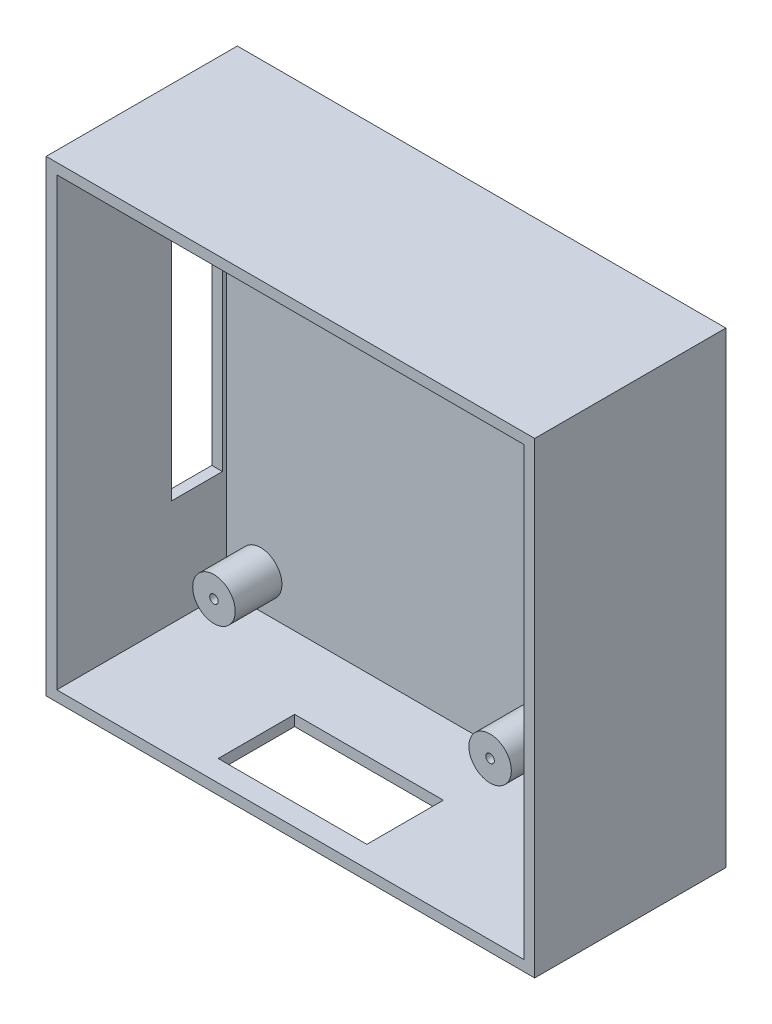
from build123d import *

# Parameters (mm, degrees)
SKETCH1_W           = 115
SKETCH1_H           = 110
BOSS_EXTRUDE1_DEPTH = 45
SKETCH2_W           = 110
SKETCH2_H           = 105
CUT_EXTRUDE1_DEPTH  = 40
SKETCH10_R          = 5
BOSS_EXTRUDE4_DEPTH = 11
SKETCH11_R          = 1
CUT_EXTRUDE8_DEPTH  = 85.689137438
CUT_EXTRUDE9_REACH  = 134.027
SKETCH14_W          = 35
SKETCH14_H          = 18
SKETCH16_W          = 12
SKETCH16_H          = 60
CUT_EXTRUDE10_DEPTH = 5


with BuildPart() as part:
    # Sketch1 → Boss-Extrude1 (new body)
    with BuildSketch(Plane.XY):
        Rectangle(SKETCH1_W, SKETCH1_H)
    extrude(amount=BOSS_EXTRUDE1_DEPTH)

    # Sketch2 → Cut-Extrude1 (cut)
    with BuildSketch(Plane.XY.offset(45)):
        Rectangle(SKETCH2_W, SKETCH2_H)
    extrude(amount=-CUT_EXTRUDE1_DEPTH, mode=Mode.SUBTRACT)

    # Sketch10 → Boss-Extrude4 (add)
    with BuildSketch(Plane.XY.offset(5)):
        with Locations(Location((-47, -44.5, 0), (0, 0, 180))):
            Circle(SKETCH10_R)
        with Locations(Location((18, -44.5, 0), (0, 0, 180))):
            Circle(SKETCH10_R)
        with Locations(Location((-47, 44.5, 0), (0, 0, 180))):
            Circle(SKETCH10_R)
        with Locations(Location((18, 44.5, 0), (0, 0, 180))):
            Circle(SKETCH10_R)
    extrude(amount=BOSS_EXTRUDE4_DEPTH)

    # Sketch11 → Cut-Extrude8 (cut, through all)
    with BuildSketch(Plane.XY.offset(16)):
        with Locations((-47, 44.5)):
            Circle(SKETCH11_R)
        with Locations((18, 44.5)):
            Circle(SKETCH11_R)
        with Locations((18, -44.5)):
            Circle(SKETCH11_R)
        with Locations((-47, -44.5)):
            Circle(SKETCH11_R)
    extrude(amount=-CUT_EXTRUDE8_DEPTH, mode=Mode.SUBTRACT)

    # Sketch14 → Cut-Extrude9 (cut, up to next)
    with BuildSketch(Plane.XZ.offset(55), mode=Mode.PRIVATE) as cut_extrude9_sk1:
        with Locations((-4.5, 31)):
            Rectangle(SKETCH14_W, SKETCH14_H)
    cut_extrude9_tool1 = extrude(cut_extrude9_sk1.sketch, amount=-CUT_EXTRUDE9_REACH, mode=Mode.PRIVATE) & part.part
    add(cut_extrude9_tool1.solids().sort_by_distance((-4.5, -55, 31))[0], mode=Mode.SUBTRACT)

    # Sketch16 → Cut-Extrude10 (cut)
    with BuildSketch(Plane.ZY.offset(57.5)):
        with Locations((12, 2.5)):
            Rectangle(SKETCH16_W, SKETCH16_H)
    extrude(amount=-CUT_EXTRUDE10_DEPTH, mode=Mode.SUBTRACT)


solid = part.part
